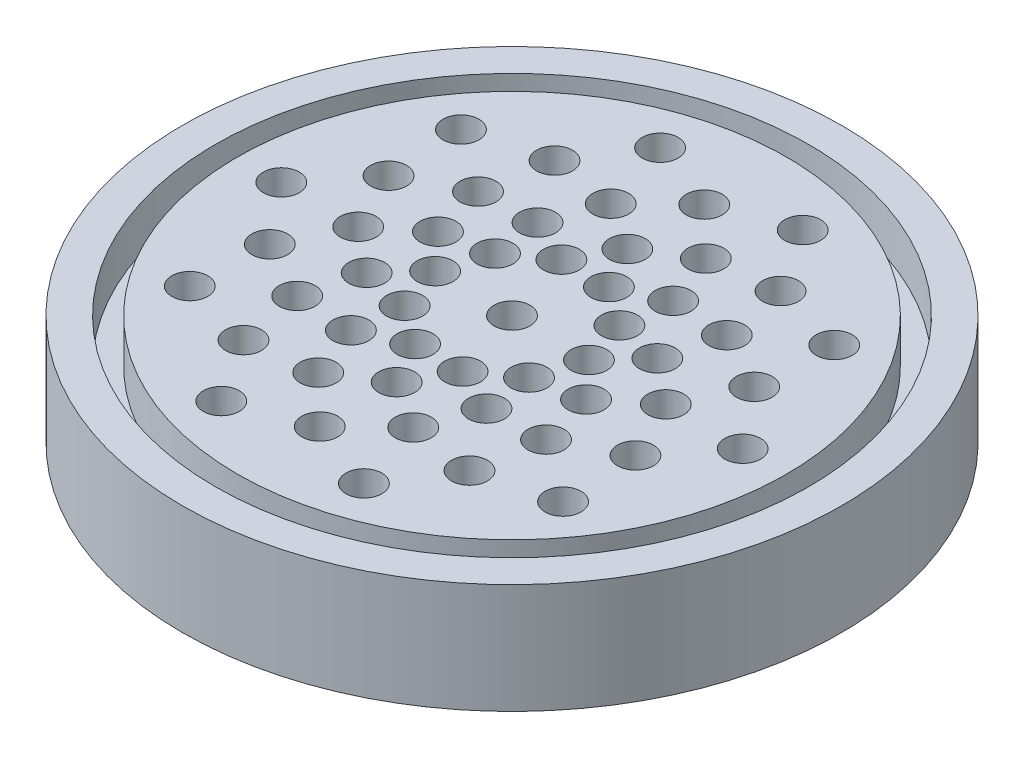
from build123d import *

# Parameters (mm, degrees)
SKETCH1_R                    = 30
BOSS_EXTRUDE1_DEPTH          = 10
SKETCH2_R                    = 1.6375
CUT_EXTRUDE1_DEPTH           = 44.588989435
LPATTERN1_COUNT              = 4
LPATTERN1_PITCH              = 7
SKETCH3_R                    = 1.6375
CUT_EXTRUDE2_DEPTH           = 44.588989435
LPATTERN2_COUNT              = 2
LPATTERN2_PITCH              = 7
CIRPATTERN1_COUNT            = 10
CIRPATTERN1_COPY_1_SKETCH_R  = 1.6375
CIRPATTERN1_COPY_1_DEPTH     = 44.588989435
CIRPATTERN1_COPY_2_SKETCH_R  = 1.6375
CIRPATTERN1_COPY_2_DEPTH     = 44.588989435
CIRPATTERN1_COPY_3_SKETCH_R  = 1.6375
CIRPATTERN1_COPY_3_DEPTH     = 44.588989435
CIRPATTERN1_COPY_4_SKETCH_R  = 1.6375
CIRPATTERN1_COPY_4_DEPTH     = 44.588989435
CIRPATTERN1_COPY_5_SKETCH_R  = 1.6375
CIRPATTERN1_COPY_5_DEPTH     = 44.588989435
CIRPATTERN1_COPY_6_SKETCH_R  = 1.6375
CIRPATTERN1_COPY_6_DEPTH     = 44.588989435
CIRPATTERN1_COPY_7_SKETCH_R  = 1.6375
CIRPATTERN1_COPY_7_DEPTH     = 44.588989435
CIRPATTERN1_COPY_8_SKETCH_R  = 1.6375
CIRPATTERN1_COPY_8_DEPTH     = 44.588989435
CIRPATTERN1_COPY_9_SKETCH_R  = 1.6375
CIRPATTERN1_COPY_9_DEPTH     = 44.588989435
CIRPATTERN1_COPY_10_SKETCH_R = 1.6375
CIRPATTERN1_COPY_10_DEPTH    = 44.588989435
CIRPATTERN1_COPY_11_SKETCH_R = 1.6375
CIRPATTERN1_COPY_11_DEPTH    = 44.588989435
CIRPATTERN1_COPY_12_SKETCH_R = 1.6375
CIRPATTERN1_COPY_12_DEPTH    = 44.588989435
CIRPATTERN1_COPY_13_SKETCH_R = 1.6375
CIRPATTERN1_COPY_13_DEPTH    = 44.588989435
CIRPATTERN1_COPY_14_SKETCH_R = 1.6375
CIRPATTERN1_COPY_14_DEPTH    = 44.588989435
CIRPATTERN1_COPY_15_SKETCH_R = 1.6375
CIRPATTERN1_COPY_15_DEPTH    = 44.588989435
CIRPATTERN1_COPY_16_SKETCH_R = 1.6375
CIRPATTERN1_COPY_16_DEPTH    = 44.588989435
CIRPATTERN1_COPY_17_SKETCH_R = 1.6375
CIRPATTERN1_COPY_17_DEPTH    = 44.588989435
CIRPATTERN1_COPY_18_SKETCH_R = 1.6375
CIRPATTERN1_COPY_18_DEPTH    = 44.588989435
CIRPATTERN1_COPY_19_SKETCH_R = 1.6375
CIRPATTERN1_COPY_19_DEPTH    = 44.588989435
CIRPATTERN1_COPY_20_SKETCH_R = 1.6375
CIRPATTERN1_COPY_20_DEPTH    = 44.588989435
CIRPATTERN1_COPY_21_SKETCH_R = 1.6375
CIRPATTERN1_COPY_21_DEPTH    = 44.588989435
CIRPATTERN1_COPY_22_SKETCH_R = 1.6375
CIRPATTERN1_COPY_22_DEPTH    = 44.588989435
CIRPATTERN1_COPY_23_SKETCH_R = 1.6375
CIRPATTERN1_COPY_23_DEPTH    = 44.588989435
CIRPATTERN1_COPY_24_SKETCH_R = 1.6375
CIRPATTERN1_COPY_24_DEPTH    = 44.588989435
CIRPATTERN1_COPY_25_SKETCH_R = 1.6375
CIRPATTERN1_COPY_25_DEPTH    = 44.588989435
CIRPATTERN1_COPY_26_SKETCH_R = 1.6375
CIRPATTERN1_COPY_26_DEPTH    = 44.588989435
CIRPATTERN1_COPY_27_SKETCH_R = 1.6375
CIRPATTERN1_COPY_27_DEPTH    = 44.588989435
CIRPATTERN1_COPY_28_SKETCH_R = 1.6375
CIRPATTERN1_COPY_28_DEPTH    = 44.588989435
CIRPATTERN1_COPY_29_SKETCH_R = 1.6375
CIRPATTERN1_COPY_29_DEPTH    = 44.588989435
CIRPATTERN1_COPY_30_SKETCH_R = 1.6375
CIRPATTERN1_COPY_30_DEPTH    = 44.588989435
CIRPATTERN1_COPY_31_SKETCH_R = 1.6375
CIRPATTERN1_COPY_31_DEPTH    = 44.588989435
CIRPATTERN1_COPY_32_SKETCH_R = 1.6375
CIRPATTERN1_COPY_32_DEPTH    = 44.588989435
CIRPATTERN1_COPY_33_SKETCH_R = 1.6375
CIRPATTERN1_COPY_33_DEPTH    = 44.588989435
CIRPATTERN1_COPY_34_SKETCH_R = 1.6375
CIRPATTERN1_COPY_34_DEPTH    = 44.588989435
CIRPATTERN1_COPY_35_SKETCH_R = 1.6375
CIRPATTERN1_COPY_35_DEPTH    = 44.588989435
CIRPATTERN1_COPY_36_SKETCH_R = 1.6375
CIRPATTERN1_COPY_36_DEPTH    = 44.588989435
CIRPATTERN1_COPY_37_SKETCH_R = 1.6375
CIRPATTERN1_COPY_37_DEPTH    = 44.588989435
CIRPATTERN1_COPY_38_SKETCH_R = 1.6375
CIRPATTERN1_COPY_38_DEPTH    = 44.588989435
CIRPATTERN1_COPY_39_SKETCH_R = 1.6375
CIRPATTERN1_COPY_39_DEPTH    = 44.588989435
CIRPATTERN1_COPY_40_SKETCH_R = 1.6375
CIRPATTERN1_COPY_40_DEPTH    = 44.588989435
CIRPATTERN1_COPY_41_SKETCH_R = 1.6375
CIRPATTERN1_COPY_41_DEPTH    = 44.588989435
CIRPATTERN1_COPY_42_SKETCH_R = 1.6375
CIRPATTERN1_COPY_42_DEPTH    = 44.588989435
CIRPATTERN1_COPY_43_SKETCH_R = 1.6375
CIRPATTERN1_COPY_43_DEPTH    = 44.588989435
CIRPATTERN1_COPY_44_SKETCH_R = 1.6375
CIRPATTERN1_COPY_44_DEPTH    = 44.588989435
CIRPATTERN1_COPY_45_SKETCH_R = 1.6375
CIRPATTERN1_COPY_45_DEPTH    = 44.588989435
M4X0_7_TAPPED_HOLE1_D        = 3.3
M4X0_7_TAPPED_HOLE1_DEPTH    = 4
M4X0_7_TAPPED_HOLE1_TIP      = 0.991420021
SKETCH6_W                    = 2
SKETCH6_H                    = 4


with BuildPart() as part:
    # Sketch1 → Boss-Extrude1 (new body)
    with BuildSketch(Plane(origin=(0, 0, 0), x_dir=(1, 0, 0), z_dir=(0, 1, 0))):
        with Locations(Location((0, 0, 0), (0, 0, 270))):
            Circle(SKETCH1_R)
    extrude(amount=BOSS_EXTRUDE1_DEPTH)

    # Sketch2 → Cut-Extrude1 (cut, through all)
    with BuildSketch(Plane(origin=(0, 0, 0), x_dir=(-1, 0, 0), z_dir=(0, -1, 0))):
        with Locations(Location((0, 0, 0), (0, 0, 90))):
            Circle(SKETCH2_R)
    cut_extrude1 = extrude(amount=-CUT_EXTRUDE1_DEPTH, mode=Mode.SUBTRACT)

    # LPattern1: Cut-Extrude1 ×4
    with Locations(*[(i * LPATTERN1_PITCH, 0, 0) for i in range(1, LPATTERN1_COUNT)]):
        add(cut_extrude1, mode=Mode.SUBTRACT)

    # Sketch3 → Cut-Extrude2 (cut, through all)
    with BuildSketch(Plane.XZ):
        with Locations(Location((0, -10.5, 0), (0, 0, 270))):
            Circle(SKETCH3_R)
    cut_extrude2 = extrude(amount=-CUT_EXTRUDE2_DEPTH, mode=Mode.SUBTRACT)

    # LPattern2: Cut-Extrude2 ×2
    with Locations(*[(0, 0, -i * LPATTERN2_PITCH) for i in range(1, LPATTERN2_COUNT)]):
        add(cut_extrude2, mode=Mode.SUBTRACT)

    # CirPattern1: Cut-Extrude2 ×10 about axis
    cirpattern1_axis = Axis((0, 0, 0), (0, 1, 0))
    for i in range(1, CIRPATTERN1_COUNT):
        add(cut_extrude2.rotate(cirpattern1_axis, i * 360 / CIRPATTERN1_COUNT), mode=Mode.SUBTRACT)

    # CirPattern1 copy 1 sketch → CirPattern1 copy 1 (cut, through all)
    with BuildSketch(Plane(origin=(5.663118961, 0, -4.114496766), x_dir=(-0.8090169943749475, 0, 0.5877852522924731), z_dir=(0, -1, 0))):
        with Locations(Location((0, 0, 0), (0, 0, 90))):
            Circle(CIRPATTERN1_COPY_1_SKETCH_R)
    extrude(amount=-CIRPATTERN1_COPY_1_DEPTH, mode=Mode.SUBTRACT)

    # CirPattern1 copy 2 sketch → CirPattern1 copy 2 (cut, through all)
    with BuildSketch(Plane(origin=(2.163118961, 0, -6.657395614), x_dir=(-0.30901699437494745, 0, 0.9510565162951535), z_dir=(0, -1, 0))):
        with Locations(Location((0, 0, 0), (0, 0, 90))):
            Circle(CIRPATTERN1_COPY_2_SKETCH_R)
    extrude(amount=-CIRPATTERN1_COPY_2_DEPTH, mode=Mode.SUBTRACT)

    # CirPattern1 copy 3 sketch → CirPattern1 copy 3 (cut, through all)
    with BuildSketch(Plane(origin=(-2.163118961, 0, -6.657395614), x_dir=(0.30901699437494734, 0, 0.9510565162951536), z_dir=(0, -1, 0))):
        with Locations(Location((0, 0, 0), (0, 0, 90))):
            Circle(CIRPATTERN1_COPY_3_SKETCH_R)
    extrude(amount=-CIRPATTERN1_COPY_3_DEPTH, mode=Mode.SUBTRACT)

    # CirPattern1 copy 4 sketch → CirPattern1 copy 4 (cut, through all)
    with BuildSketch(Plane(origin=(-5.663118961, 0, -4.114496766), x_dir=(0.8090169943749473, 0, 0.5877852522924732), z_dir=(0, -1, 0))):
        with Locations(Location((0, 0, 0), (0, 0, 90))):
            Circle(CIRPATTERN1_COPY_4_SKETCH_R)
    extrude(amount=-CIRPATTERN1_COPY_4_DEPTH, mode=Mode.SUBTRACT)

    # CirPattern1 copy 5 sketch → CirPattern1 copy 5 (cut, through all)
    with BuildSketch(Plane(origin=(-7, 0, 0), x_dir=(1, 0, 0), z_dir=(0, -1, 0))):
        with Locations(Location((0, 0, 0), (0, 0, 90))):
            Circle(CIRPATTERN1_COPY_5_SKETCH_R)
    extrude(amount=-CIRPATTERN1_COPY_5_DEPTH, mode=Mode.SUBTRACT)

    # CirPattern1 copy 6 sketch → CirPattern1 copy 6 (cut, through all)
    with BuildSketch(Plane(origin=(-5.663118961, 0, 4.114496766), x_dir=(0.8090169943749476, 0, -0.587785252292473), z_dir=(0, -1, 0))):
        with Locations(Location((0, 0, 0), (0, 0, 90))):
            Circle(CIRPATTERN1_COPY_6_SKETCH_R)
    extrude(amount=-CIRPATTERN1_COPY_6_DEPTH, mode=Mode.SUBTRACT)

    # CirPattern1 copy 7 sketch → CirPattern1 copy 7 (cut, through all)
    with BuildSketch(Plane(origin=(-2.163118961, 0, 6.657395614), x_dir=(0.30901699437494756, 0, -0.9510565162951535), z_dir=(0, -1, 0))):
        with Locations(Location((0, 0, 0), (0, 0, 90))):
            Circle(CIRPATTERN1_COPY_7_SKETCH_R)
    extrude(amount=-CIRPATTERN1_COPY_7_DEPTH, mode=Mode.SUBTRACT)

    # CirPattern1 copy 8 sketch → CirPattern1 copy 8 (cut, through all)
    with BuildSketch(Plane(origin=(2.163118961, 0, 6.657395614), x_dir=(-0.30901699437494723, 0, -0.9510565162951536), z_dir=(0, -1, 0))):
        with Locations(Location((0, 0, 0), (0, 0, 90))):
            Circle(CIRPATTERN1_COPY_8_SKETCH_R)
    extrude(amount=-CIRPATTERN1_COPY_8_DEPTH, mode=Mode.SUBTRACT)

    # CirPattern1 copy 9 sketch → CirPattern1 copy 9 (cut, through all)
    with BuildSketch(Plane(origin=(5.663118961, 0, 4.114496766), x_dir=(-0.8090169943749473, 0, -0.5877852522924734), z_dir=(0, -1, 0))):
        with Locations(Location((0, 0, 0), (0, 0, 90))):
            Circle(CIRPATTERN1_COPY_9_SKETCH_R)
    extrude(amount=-CIRPATTERN1_COPY_9_DEPTH, mode=Mode.SUBTRACT)

    # CirPattern1 copy 10 sketch → CirPattern1 copy 10 (cut, through all)
    with BuildSketch(Plane(origin=(11.326237921, 0, -8.228993532), x_dir=(-0.8090169943749475, 0, 0.5877852522924731), z_dir=(0, -1, 0))):
        with Locations(Location((0, 0, 0), (0, 0, 90))):
            Circle(CIRPATTERN1_COPY_10_SKETCH_R)
    extrude(amount=-CIRPATTERN1_COPY_10_DEPTH, mode=Mode.SUBTRACT)

    # CirPattern1 copy 11 sketch → CirPattern1 copy 11 (cut, through all)
    with BuildSketch(Plane(origin=(4.326237921, 0, -13.314791228), x_dir=(-0.30901699437494745, 0, 0.9510565162951535), z_dir=(0, -1, 0))):
        with Locations(Location((0, 0, 0), (0, 0, 90))):
            Circle(CIRPATTERN1_COPY_11_SKETCH_R)
    extrude(amount=-CIRPATTERN1_COPY_11_DEPTH, mode=Mode.SUBTRACT)

    # CirPattern1 copy 12 sketch → CirPattern1 copy 12 (cut, through all)
    with BuildSketch(Plane(origin=(-4.326237921, 0, -13.314791228), x_dir=(0.30901699437494734, 0, 0.9510565162951536), z_dir=(0, -1, 0))):
        with Locations(Location((0, 0, 0), (0, 0, 90))):
            Circle(CIRPATTERN1_COPY_12_SKETCH_R)
    extrude(amount=-CIRPATTERN1_COPY_12_DEPTH, mode=Mode.SUBTRACT)

    # CirPattern1 copy 13 sketch → CirPattern1 copy 13 (cut, through all)
    with BuildSketch(Plane(origin=(-11.326237921, 0, -8.228993532), x_dir=(0.8090169943749473, 0, 0.5877852522924732), z_dir=(0, -1, 0))):
        with Locations(Location((0, 0, 0), (0, 0, 90))):
            Circle(CIRPATTERN1_COPY_13_SKETCH_R)
    extrude(amount=-CIRPATTERN1_COPY_13_DEPTH, mode=Mode.SUBTRACT)

    # CirPattern1 copy 14 sketch → CirPattern1 copy 14 (cut, through all)
    with BuildSketch(Plane(origin=(-14, 0, 0), x_dir=(1, 0, 0), z_dir=(0, -1, 0))):
        with Locations(Location((0, 0, 0), (0, 0, 90))):
            Circle(CIRPATTERN1_COPY_14_SKETCH_R)
    extrude(amount=-CIRPATTERN1_COPY_14_DEPTH, mode=Mode.SUBTRACT)

    # CirPattern1 copy 15 sketch → CirPattern1 copy 15 (cut, through all)
    with BuildSketch(Plane(origin=(-11.326237921, 0, 8.228993532), x_dir=(0.8090169943749476, 0, -0.587785252292473), z_dir=(0, -1, 0))):
        with Locations(Location((0, 0, 0), (0, 0, 90))):
            Circle(CIRPATTERN1_COPY_15_SKETCH_R)
    extrude(amount=-CIRPATTERN1_COPY_15_DEPTH, mode=Mode.SUBTRACT)

    # CirPattern1 copy 16 sketch → CirPattern1 copy 16 (cut, through all)
    with BuildSketch(Plane(origin=(-4.326237921, 0, 13.314791228), x_dir=(0.30901699437494756, 0, -0.9510565162951535), z_dir=(0, -1, 0))):
        with Locations(Location((0, 0, 0), (0, 0, 90))):
            Circle(CIRPATTERN1_COPY_16_SKETCH_R)
    extrude(amount=-CIRPATTERN1_COPY_16_DEPTH, mode=Mode.SUBTRACT)

    # CirPattern1 copy 17 sketch → CirPattern1 copy 17 (cut, through all)
    with BuildSketch(Plane(origin=(4.326237921, 0, 13.314791228), x_dir=(-0.30901699437494723, 0, -0.9510565162951536), z_dir=(0, -1, 0))):
        with Locations(Location((0, 0, 0), (0, 0, 90))):
            Circle(CIRPATTERN1_COPY_17_SKETCH_R)
    extrude(amount=-CIRPATTERN1_COPY_17_DEPTH, mode=Mode.SUBTRACT)

    # CirPattern1 copy 18 sketch → CirPattern1 copy 18 (cut, through all)
    with BuildSketch(Plane(origin=(11.326237921, 0, 8.228993532), x_dir=(-0.8090169943749473, 0, -0.5877852522924734), z_dir=(0, -1, 0))):
        with Locations(Location((0, 0, 0), (0, 0, 90))):
            Circle(CIRPATTERN1_COPY_18_SKETCH_R)
    extrude(amount=-CIRPATTERN1_COPY_18_DEPTH, mode=Mode.SUBTRACT)

    # CirPattern1 copy 19 sketch → CirPattern1 copy 19 (cut, through all)
    with BuildSketch(Plane(origin=(16.989356882, 0, -12.343490298), x_dir=(-0.8090169943749475, 0, 0.5877852522924731), z_dir=(0, -1, 0))):
        with Locations(Location((0, 0, 0), (0, 0, 90))):
            Circle(CIRPATTERN1_COPY_19_SKETCH_R)
    extrude(amount=-CIRPATTERN1_COPY_19_DEPTH, mode=Mode.SUBTRACT)

    # CirPattern1 copy 20 sketch → CirPattern1 copy 20 (cut, through all)
    with BuildSketch(Plane(origin=(6.489356882, 0, -19.972186842), x_dir=(-0.30901699437494745, 0, 0.9510565162951535), z_dir=(0, -1, 0))):
        with Locations(Location((0, 0, 0), (0, 0, 90))):
            Circle(CIRPATTERN1_COPY_20_SKETCH_R)
    extrude(amount=-CIRPATTERN1_COPY_20_DEPTH, mode=Mode.SUBTRACT)

    # CirPattern1 copy 21 sketch → CirPattern1 copy 21 (cut, through all)
    with BuildSketch(Plane(origin=(-6.489356882, 0, -19.972186842), x_dir=(0.30901699437494734, 0, 0.9510565162951536), z_dir=(0, -1, 0))):
        with Locations(Location((0, 0, 0), (0, 0, 90))):
            Circle(CIRPATTERN1_COPY_21_SKETCH_R)
    extrude(amount=-CIRPATTERN1_COPY_21_DEPTH, mode=Mode.SUBTRACT)

    # CirPattern1 copy 22 sketch → CirPattern1 copy 22 (cut, through all)
    with BuildSketch(Plane(origin=(-16.989356882, 0, -12.343490298), x_dir=(0.8090169943749473, 0, 0.5877852522924732), z_dir=(0, -1, 0))):
        with Locations(Location((0, 0, 0), (0, 0, 90))):
            Circle(CIRPATTERN1_COPY_22_SKETCH_R)
    extrude(amount=-CIRPATTERN1_COPY_22_DEPTH, mode=Mode.SUBTRACT)

    # CirPattern1 copy 23 sketch → CirPattern1 copy 23 (cut, through all)
    with BuildSketch(Plane(origin=(-21, 0, 0), x_dir=(1, 0, 0), z_dir=(0, -1, 0))):
        with Locations(Location((0, 0, 0), (0, 0, 90))):
            Circle(CIRPATTERN1_COPY_23_SKETCH_R)
    extrude(amount=-CIRPATTERN1_COPY_23_DEPTH, mode=Mode.SUBTRACT)

    # CirPattern1 copy 24 sketch → CirPattern1 copy 24 (cut, through all)
    with BuildSketch(Plane(origin=(-16.989356882, 0, 12.343490298), x_dir=(0.8090169943749476, 0, -0.587785252292473), z_dir=(0, -1, 0))):
        with Locations(Location((0, 0, 0), (0, 0, 90))):
            Circle(CIRPATTERN1_COPY_24_SKETCH_R)
    extrude(amount=-CIRPATTERN1_COPY_24_DEPTH, mode=Mode.SUBTRACT)

    # CirPattern1 copy 25 sketch → CirPattern1 copy 25 (cut, through all)
    with BuildSketch(Plane(origin=(-6.489356882, 0, 19.972186842), x_dir=(0.30901699437494756, 0, -0.9510565162951535), z_dir=(0, -1, 0))):
        with Locations(Location((0, 0, 0), (0, 0, 90))):
            Circle(CIRPATTERN1_COPY_25_SKETCH_R)
    extrude(amount=-CIRPATTERN1_COPY_25_DEPTH, mode=Mode.SUBTRACT)

    # CirPattern1 copy 26 sketch → CirPattern1 copy 26 (cut, through all)
    with BuildSketch(Plane(origin=(6.489356882, 0, 19.972186842), x_dir=(-0.30901699437494723, 0, -0.9510565162951536), z_dir=(0, -1, 0))):
        with Locations(Location((0, 0, 0), (0, 0, 90))):
            Circle(CIRPATTERN1_COPY_26_SKETCH_R)
    extrude(amount=-CIRPATTERN1_COPY_26_DEPTH, mode=Mode.SUBTRACT)

    # CirPattern1 copy 27 sketch → CirPattern1 copy 27 (cut, through all)
    with BuildSketch(Plane(origin=(16.989356882, 0, 12.343490298), x_dir=(-0.8090169943749473, 0, -0.5877852522924734), z_dir=(0, -1, 0))):
        with Locations(Location((0, 0, 0), (0, 0, 90))):
            Circle(CIRPATTERN1_COPY_27_SKETCH_R)
    extrude(amount=-CIRPATTERN1_COPY_27_DEPTH, mode=Mode.SUBTRACT)

    # CirPattern1 copy 28 sketch → CirPattern1 copy 28 (cut, through all)
    with BuildSketch(Plane(origin=(0, 0, 0), x_dir=(-0.8090169943749475, 0, 0.5877852522924731), z_dir=(0, -1, 0))):
        with Locations(Location((0, 0, 0), (0, 0, 90))):
            Circle(CIRPATTERN1_COPY_28_SKETCH_R)
    extrude(amount=-CIRPATTERN1_COPY_28_DEPTH, mode=Mode.SUBTRACT)

    # CirPattern1 copy 29 sketch → CirPattern1 copy 29 (cut, through all)
    with BuildSketch(Plane(origin=(0, 0, 0), x_dir=(-0.30901699437494745, 0, 0.9510565162951535), z_dir=(0, -1, 0))):
        with Locations(Location((0, 0, 0), (0, 0, 90))):
            Circle(CIRPATTERN1_COPY_29_SKETCH_R)
    extrude(amount=-CIRPATTERN1_COPY_29_DEPTH, mode=Mode.SUBTRACT)

    # CirPattern1 copy 30 sketch → CirPattern1 copy 30 (cut, through all)
    with BuildSketch(Plane(origin=(0, 0, 0), x_dir=(0.30901699437494734, 0, 0.9510565162951536), z_dir=(0, -1, 0))):
        with Locations(Location((0, 0, 0), (0, 0, 90))):
            Circle(CIRPATTERN1_COPY_30_SKETCH_R)
    extrude(amount=-CIRPATTERN1_COPY_30_DEPTH, mode=Mode.SUBTRACT)

    # CirPattern1 copy 31 sketch → CirPattern1 copy 31 (cut, through all)
    with BuildSketch(Plane(origin=(0, 0, 0), x_dir=(0.8090169943749473, 0, 0.5877852522924732), z_dir=(0, -1, 0))):
        with Locations(Location((0, 0, 0), (0, 0, 90))):
            Circle(CIRPATTERN1_COPY_31_SKETCH_R)
    extrude(amount=-CIRPATTERN1_COPY_31_DEPTH, mode=Mode.SUBTRACT)

    # CirPattern1 copy 32 sketch → CirPattern1 copy 32 (cut, through all)
    with BuildSketch(Plane.XZ):
        with Locations(Location((0, 0, 0), (0, 0, 90))):
            Circle(CIRPATTERN1_COPY_32_SKETCH_R)
    extrude(amount=-CIRPATTERN1_COPY_32_DEPTH, mode=Mode.SUBTRACT)

    # CirPattern1 copy 33 sketch → CirPattern1 copy 33 (cut, through all)
    with BuildSketch(Plane(origin=(0, 0, 0), x_dir=(0.8090169943749476, 0, -0.587785252292473), z_dir=(0, -1, 0))):
        with Locations(Location((0, 0, 0), (0, 0, 90))):
            Circle(CIRPATTERN1_COPY_33_SKETCH_R)
    extrude(amount=-CIRPATTERN1_COPY_33_DEPTH, mode=Mode.SUBTRACT)

    # CirPattern1 copy 34 sketch → CirPattern1 copy 34 (cut, through all)
    with BuildSketch(Plane(origin=(0, 0, 0), x_dir=(0.30901699437494756, 0, -0.9510565162951535), z_dir=(0, -1, 0))):
        with Locations(Location((0, 0, 0), (0, 0, 90))):
            Circle(CIRPATTERN1_COPY_34_SKETCH_R)
    extrude(amount=-CIRPATTERN1_COPY_34_DEPTH, mode=Mode.SUBTRACT)

    # CirPattern1 copy 35 sketch → CirPattern1 copy 35 (cut, through all)
    with BuildSketch(Plane(origin=(0, 0, 0), x_dir=(-0.30901699437494723, 0, -0.9510565162951536), z_dir=(0, -1, 0))):
        with Locations(Location((0, 0, 0), (0, 0, 90))):
            Circle(CIRPATTERN1_COPY_35_SKETCH_R)
    extrude(amount=-CIRPATTERN1_COPY_35_DEPTH, mode=Mode.SUBTRACT)

    # CirPattern1 copy 36 sketch → CirPattern1 copy 36 (cut, through all)
    with BuildSketch(Plane(origin=(0, 0, 0), x_dir=(-0.8090169943749473, 0, -0.5877852522924734), z_dir=(0, -1, 0))):
        with Locations(Location((0, 0, 0), (0, 0, 90))):
            Circle(CIRPATTERN1_COPY_36_SKETCH_R)
    extrude(amount=-CIRPATTERN1_COPY_36_DEPTH, mode=Mode.SUBTRACT)

    # CirPattern1 copy 37 sketch → CirPattern1 copy 37 (cut, through all)
    with BuildSketch(Plane(origin=(-4.114496766, 0, -5.663118961), x_dir=(0.8090169943749475, 0, -0.5877852522924731), z_dir=(0, -1, 0))):
        with Locations(Location((0, -10.5, 0), (0, 0, 270))):
            Circle(CIRPATTERN1_COPY_37_SKETCH_R)
    extrude(amount=-CIRPATTERN1_COPY_37_DEPTH, mode=Mode.SUBTRACT)

    # CirPattern1 copy 38 sketch → CirPattern1 copy 38 (cut, through all)
    with BuildSketch(Plane(origin=(-6.657395614, 0, -2.163118961), x_dir=(0.30901699437494745, 0, -0.9510565162951535), z_dir=(0, -1, 0))):
        with Locations(Location((0, -10.5, 0), (0, 0, 270))):
            Circle(CIRPATTERN1_COPY_38_SKETCH_R)
    extrude(amount=-CIRPATTERN1_COPY_38_DEPTH, mode=Mode.SUBTRACT)

    # CirPattern1 copy 39 sketch → CirPattern1 copy 39 (cut, through all)
    with BuildSketch(Plane(origin=(-6.657395614, 0, 2.163118961), x_dir=(-0.30901699437494734, 0, -0.9510565162951536), z_dir=(0, -1, 0))):
        with Locations(Location((0, -10.5, 0), (0, 0, 270))):
            Circle(CIRPATTERN1_COPY_39_SKETCH_R)
    extrude(amount=-CIRPATTERN1_COPY_39_DEPTH, mode=Mode.SUBTRACT)

    # CirPattern1 copy 40 sketch → CirPattern1 copy 40 (cut, through all)
    with BuildSketch(Plane(origin=(-4.114496766, 0, 5.663118961), x_dir=(-0.8090169943749473, 0, -0.5877852522924732), z_dir=(0, -1, 0))):
        with Locations(Location((0, -10.5, 0), (0, 0, 270))):
            Circle(CIRPATTERN1_COPY_40_SKETCH_R)
    extrude(amount=-CIRPATTERN1_COPY_40_DEPTH, mode=Mode.SUBTRACT)

    # CirPattern1 copy 41 sketch → CirPattern1 copy 41 (cut, through all)
    with BuildSketch(Plane(origin=(0, 0, 7), x_dir=(-1, 0, 0), z_dir=(0, -1, 0))):
        with Locations(Location((0, -10.5, 0), (0, 0, 270))):
            Circle(CIRPATTERN1_COPY_41_SKETCH_R)
    extrude(amount=-CIRPATTERN1_COPY_41_DEPTH, mode=Mode.SUBTRACT)

    # CirPattern1 copy 42 sketch → CirPattern1 copy 42 (cut, through all)
    with BuildSketch(Plane(origin=(4.114496766, 0, 5.663118961), x_dir=(-0.8090169943749476, 0, 0.587785252292473), z_dir=(0, -1, 0))):
        with Locations(Location((0, -10.5, 0), (0, 0, 270))):
            Circle(CIRPATTERN1_COPY_42_SKETCH_R)
    extrude(amount=-CIRPATTERN1_COPY_42_DEPTH, mode=Mode.SUBTRACT)

    # CirPattern1 copy 43 sketch → CirPattern1 copy 43 (cut, through all)
    with BuildSketch(Plane(origin=(6.657395614, 0, 2.163118961), x_dir=(-0.30901699437494756, 0, 0.9510565162951535), z_dir=(0, -1, 0))):
        with Locations(Location((0, -10.5, 0), (0, 0, 270))):
            Circle(CIRPATTERN1_COPY_43_SKETCH_R)
    extrude(amount=-CIRPATTERN1_COPY_43_DEPTH, mode=Mode.SUBTRACT)

    # CirPattern1 copy 44 sketch → CirPattern1 copy 44 (cut, through all)
    with BuildSketch(Plane(origin=(6.657395614, 0, -2.163118961), x_dir=(0.30901699437494723, 0, 0.9510565162951536), z_dir=(0, -1, 0))):
        with Locations(Location((0, -10.5, 0), (0, 0, 270))):
            Circle(CIRPATTERN1_COPY_44_SKETCH_R)
    extrude(amount=-CIRPATTERN1_COPY_44_DEPTH, mode=Mode.SUBTRACT)

    # CirPattern1 copy 45 sketch → CirPattern1 copy 45 (cut, through all)
    with BuildSketch(Plane(origin=(4.114496766, 0, -5.663118961), x_dir=(0.8090169943749473, 0, 0.5877852522924734), z_dir=(0, -1, 0))):
        with Locations(Location((0, -10.5, 0), (0, 0, 270))):
            Circle(CIRPATTERN1_COPY_45_SKETCH_R)
    extrude(amount=-CIRPATTERN1_COPY_45_DEPTH, mode=Mode.SUBTRACT)

    # M4x0.7 Tapped Hole1
    with Locations(Plane(origin=(0, 0, 0), x_dir=(-1, 0, 0), z_dir=(0, -1, 0))):
        with Locations((20.225424859, -14.694631307), (-7.725424859, -23.776412907), (-25, 0), (-7.725424859, 23.776412907), (20.225424859, 14.694631307)):
            Hole(M4X0_7_TAPPED_HOLE1_D / 2, depth=M4X0_7_TAPPED_HOLE1_DEPTH)
            with Locations((0, 0, -(M4X0_7_TAPPED_HOLE1_DEPTH + M4X0_7_TAPPED_HOLE1_TIP / 2))):  # 118° drill point
                Cone(0, M4X0_7_TAPPED_HOLE1_D / 2, M4X0_7_TAPPED_HOLE1_TIP, mode=Mode.SUBTRACT)

    # Sketch6 → Cut-Revolve1 (revolve, cut)
    with BuildSketch(Plane.XY, mode=Mode.PRIVATE) as cut_revolve1_sk:
        with Locations((26, 8)):
            Rectangle(SKETCH6_W, SKETCH6_H)
    revolve(cut_revolve1_sk.sketch.rotate(Axis((0, 6.3, 0), (0, -1, 0)), 90), axis=Axis((0, 6.3, 0), (0, -1, 0)), mode=Mode.SUBTRACT)


solid = part.part
